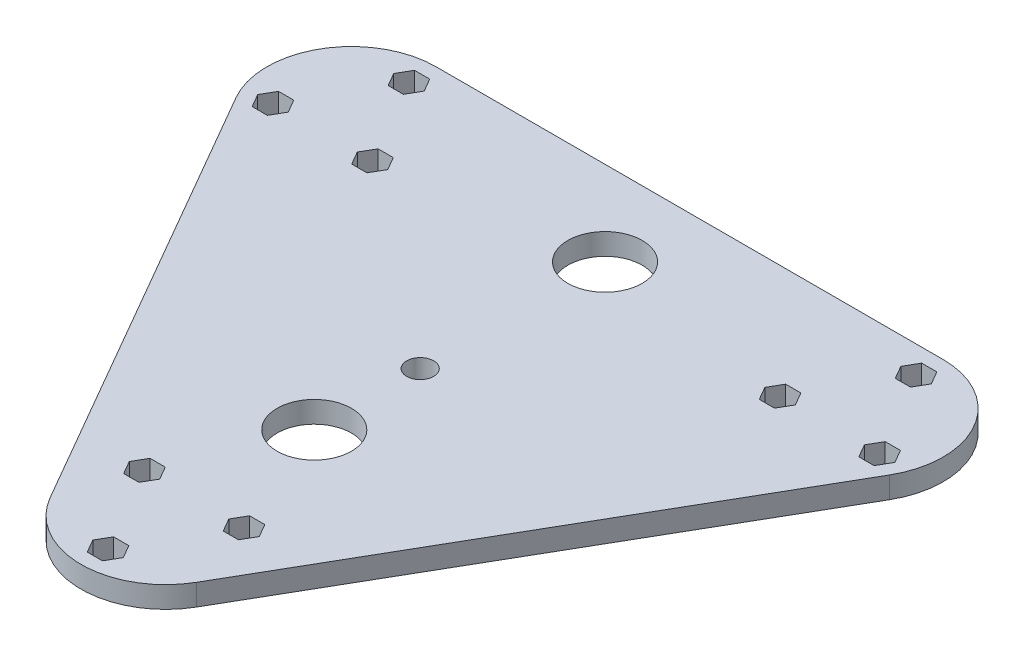
from build123d import *

# Parameters (mm, degrees)
ESQUISSE1_R             = 11
BOSS_EXTRU_1_DEPTH      = 6.35
ENL_V_MAT_EXTRU_1_DEPTH = 135.686014493
ESQUISSE4_R             = 4
ENL_V_MAT_EXTRU_2_DEPTH = 135.686014493
ESQUISSE5_R             = 11
ENL_V_MAT_EXTRU_3_DEPTH = 135.686014493


with BuildPart() as part:
    # Esquisse1 → Boss.-Extru.1 (new body)
    with BuildSketch(Plane(origin=(0, 0, 0), x_dir=(1, 0, 0), z_dir=(0, 1, 0))):
        with BuildLine():
            Line((-96.654639651, 52.506938663), (-21.654639651, -77.493061337))
            ThreePointArc((-21.654639651, -77.493061337), (0, -90), (21.654639651, -77.493061337))
            Line((21.654639651, -77.493061337), (96.654639651, 52.506938663))
            ThreePointArc((96.654639651, 52.506938663), (96.648631983, 77.50346885), (75, 90))
            Line((75, 90), (-75, 90))
            ThreePointArc((-75, 90), (-96.648631983, 77.50346885), (-96.654639651, 52.506938663))
        make_face()
        with Locations(Location((0, 65, 0), (0, 0, 270))):
            Circle(ESQUISSE1_R, mode=Mode.SUBTRACT)
    extrude(amount=BOSS_EXTRU_1_DEPTH)

    # Esquisse3 → Enlèv. mat.-Extru.1 (cut, through all)
    with BuildSketch(Plane.XZ):
        Polygon((-79.5033321, -82), (-77.25166605, -85.9), (-72.74833395, -85.9), (-70.4966679, -82), (-72.74833395, -78.1), (-77.25166605, -78.1), align=None)
        Polygon((-94.225763964, -56.5), (-91.974097914, -60.4), (-87.470765814, -60.4), (-85.219099765, -56.5), (-87.470765814, -52.6), (-91.974097914, -52.6), align=None)
        Polygon((-64.780900235, -56.5), (-62.529234186, -60.4), (-58.025902086, -60.4), (-55.774236036, -56.5), (-58.025902086, -52.6), (-62.529234186, -52.6), align=None)
        Polygon((55.775701891, -56.499154304), (58.02736794, -60.399154304), (62.53070004, -60.399154304), (64.78236609, -56.499154304), (62.53070004, -52.599154304), (58.02736794, -52.599154304), align=None)
        Polygon((70.498133755, -81.999154304), (72.749799805, -85.899154304), (77.253131904, -85.899154304), (79.504797954, -81.999154304), (77.253131904, -78.099154304), (72.749799805, -78.099154304), align=None)
        Polygon((85.220565619, -56.499154304), (87.472231669, -60.399154304), (91.975563769, -60.399154304), (94.227229819, -56.499154304), (91.975563769, -52.599154304), (87.472231669, -52.599154304), align=None)
        Polygon((-4.5033321, 82), (-2.25166605, 78.1), (2.25166605, 78.1), (4.5033321, 82), (2.25166605, 85.9), (-2.25166605, 85.9), align=None)
        Polygon((10.219099765, 56.5), (12.470765814, 52.6), (16.974097914, 52.6), (19.225763964, 56.5), (16.974097914, 60.4), (12.470765814, 60.4), align=None)
        Polygon((-19.225763964, 56.5), (-16.974097914, 52.6), (-12.470765814, 52.6), (-10.219099765, 56.5), (-12.470765814, 60.4), (-16.974097914, 60.4), align=None)
    extrude(amount=-ENL_V_MAT_EXTRU_1_DEPTH, mode=Mode.SUBTRACT)

    # Esquisse4 → Enlèv. mat.-Extru.2 (cut, through all)
    with BuildSketch(Plane(origin=(0, 6.35, 0), x_dir=(1, 0, 0), z_dir=(0, 1, 0))):
        with Locations(Location((0.000849353, 10.324999995, 0), (0, 0, 270))):
            Circle(ESQUISSE4_R)
    extrude(amount=-ENL_V_MAT_EXTRU_2_DEPTH, mode=Mode.SUBTRACT)

    # Esquisse5 → Enlèv. mat.-Extru.3 (cut, through all)
    with BuildSketch(Plane(origin=(0, 6.35, 0), x_dir=(1, 0, 0), z_dir=(0, 1, 0))):
        with Locations(Location((0, -21, 0), (0, 0, 270))):
            Circle(ESQUISSE5_R)
    extrude(amount=-ENL_V_MAT_EXTRU_3_DEPTH, mode=Mode.SUBTRACT)


solid = part.part
